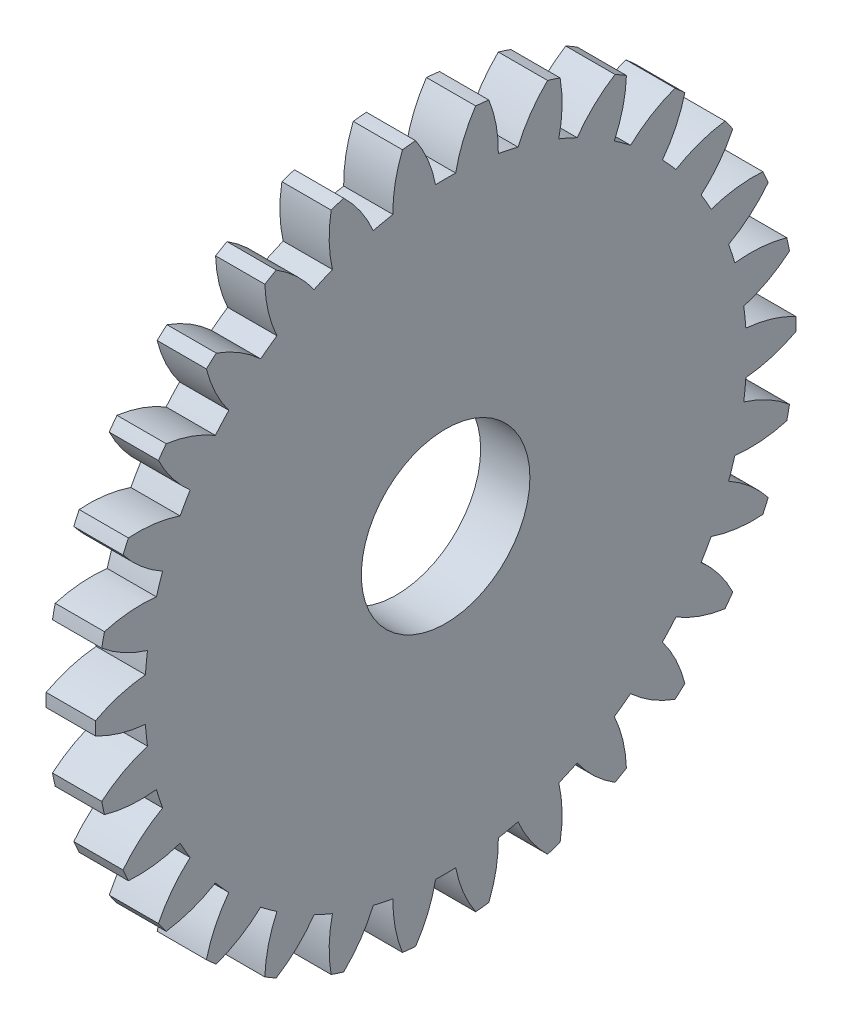
from build123d import *

# Parameters (mm, degrees)
BASPROSKE_W        = 4.5
BASPROSKE_H        = 32
TOOTHCUT_DEPTH     = 46.478016667
TEETHCUTS_COUNT    = 30
TEETHCUTS_ANGLE    = 348
BORSKE_R           = 5
BORE_DEPTH         = 50.0000508
SKETCH1_R          = 7.7
CUT_EXTRUDE1_DEPTH = 46.395068758


with BuildPart() as part:
    # BasProSke → Base-Revolve (revolve)
    with BuildSketch(Plane(origin=(0, 0, 0), x_dir=(1, 0, 0), z_dir=(0, 1, 0)), mode=Mode.PRIVATE) as base_revolve_sk:
        with Locations((2.25, 16)):
            Rectangle(BASPROSKE_W, BASPROSKE_H)
    revolve(base_revolve_sk.sketch.rotate(Axis((-10, 0, 0), (1, 0, 0)), 180), axis=Axis((-10, 0, 0), (1, 0, 0)))

    # TooCutSke → ToothCut (cut, through all)
    with BuildSketch(Plane(origin=(0, 0, 0), x_dir=(0, 0, -1), z_dir=(1, 0, 0))):
        with BuildLine():
            ThreePointArc((0.918551563, 27.483654488), (0, 27.499), (-0.918551563, 27.483654488))
            ThreePointArc((-0.918551563, 27.483654488), (-1.617208176, 29.787801627), (-2.761784709, 31.906093311))
            ThreePointArc((-2.761784709, 31.906093311), (0, 32.0254), (2.761784709, 31.906093311))
            ThreePointArc((2.761784709, 31.906093311), (1.617208176, 29.787801627), (0.918551563, 27.483654488))
        make_face()
    toothcut = extrude(amount=TOOTHCUT_DEPTH, mode=Mode.SUBTRACT)

    # TeethCuts: ToothCut ×30 about axis
    teethcuts_axis = Axis((-10, 0, 0), (1, 0, 0))
    for i in range(1, TEETHCUTS_COUNT):
        add(toothcut.rotate(teethcuts_axis, i * TEETHCUTS_ANGLE / (TEETHCUTS_COUNT - 1)), mode=Mode.SUBTRACT)

    # BorSke → Bore (cut, symmetric)
    with BuildSketch(Plane(origin=(0, 0, 0), x_dir=(0, 0, -1), z_dir=(1, 0, 0))):
        with Locations(Location((0, 0, 0), (0, 0, 180))):
            Circle(BORSKE_R)
    extrude(amount=BORE_DEPTH, both=True, mode=Mode.SUBTRACT)

    # Sketch1 → Cut-Extrude1 (cut, through all)
    with BuildSketch(Plane(origin=(4.5, 0, 0), x_dir=(0, 0, -1), z_dir=(1, 0, 0))):
        Circle(SKETCH1_R)
    extrude(amount=-CUT_EXTRUDE1_DEPTH, mode=Mode.SUBTRACT)


solid = part.part
